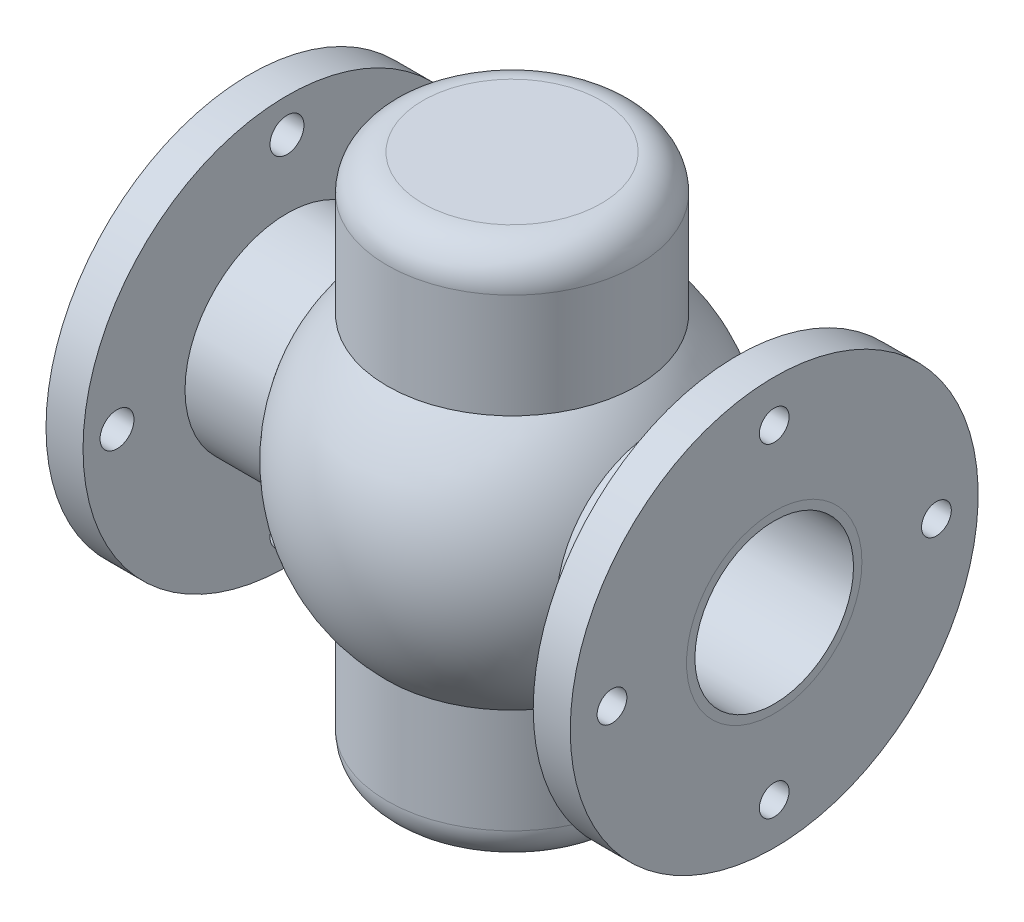
from build123d import *

# Parameters (mm, degrees)
SKETCH1_R                   = 57.15
BASE_EXTRUDE_DEPTH          = 150
BOSS_EXTRUDE1_DEPTH         = 150
BOSS_EXTRUDE1_DEPTH_BACK    = 150
SKETCH2_R                   = 70
FILLET1_R                   = 20
SKETCH18_R                  = 44.45
CUT_EXTRUDE3_DEPTH          = 351.000000086
CUT_EXTRUDE2_REACH          = 353.73
SKETCH15_R                  = 9.5
CIRPATTERN2_COUNT           = 4
SKETCH22_R                  = 67.5
CUT_EXTRUDE5_DEPTH          = 3.1
F_5_8_CLEARANCE_HOLE1_D     = 16.66748
F_5_8_CLEARANCE_HOLE1_DEPTH = 20.75


with BuildPart() as part:
    # Sketch1 → Base-Extrude (new, symmetric)
    with BuildSketch(Plane(origin=(0, 0, 0), x_dir=(0, 0, -1), z_dir=(1, 0, 0))):
        Circle(SKETCH1_R)
    extrude(amount=BASE_EXTRUDE_DEPTH, both=True)

    # Sketch2 → Boss-Extrude1 (add, two sides: drawn at the far end of the back side and taken through both)
    with BuildSketch(Plane(origin=(0, 0, 0), x_dir=(1, 0, 0), z_dir=(0, 1, 0)).offset(-BOSS_EXTRUDE1_DEPTH_BACK)):
        with Locations(Location((0, 0, 0), (0, 0, 270))):
            Circle(SKETCH2_R)
    extrude(amount=BOSS_EXTRUDE1_DEPTH + BOSS_EXTRUDE1_DEPTH_BACK)

    # Sketch3 → Boss-Revolve1 (revolve)
    with BuildSketch(Plane.XY):
        with BuildLine():
            Line((0, -100), (0, 100))
            ThreePointArc((0, 100), (100, 0), (0, -100))
        make_face()
    revolve(axis=Axis((0, -115.862970753, 0), (0, 1, 0)))

    # Fillet1
    fillet1_edges = [part.edges().sort_by_distance(p)[0] for p in [
        (0, -150, -70),
        (0, 150, -70),
    ]]
    fillet(fillet1_edges, radius=FILLET1_R)

    # Sketch18 → Cut-Extrude3 (cut, through all)
    with BuildSketch(Plane.ZY.offset(150)):
        Circle(SKETCH18_R)
    extrude(amount=-CUT_EXTRUDE3_DEPTH, mode=Mode.SUBTRACT)

    # Sketch13 → Boss-Revolve4 (revolve)
    with BuildSketch(Plane.XY, mode=Mode.PRIVATE) as boss_revolve4_sk:
        Polygon((126.15, 57.15), (126.15, 114.3), (146.9, 114.3), (146.9, 67.5), (150, 67.5), (150, 57.15), align=None)
    boss_revolve4 = revolve(boss_revolve4_sk.sketch.rotate(Axis((0, 0, 0), (1, 0, 0)), 90), axis=Axis((0, 0, 0), (1, 0, 0)))

    # Mirror2: Boss-Revolve4 across plane
    add(boss_revolve4.mirror(Plane(origin=(0, 0, 0), x_dir=(0, 0, 1), z_dir=(1, 0, 0))))

    # Sketch15 → Cut-Extrude2 (cut, up to next)
    with BuildSketch(Plane.ZY.offset(146.9), mode=Mode.PRIVATE) as cut_extrude2_sk1:
        with Locations((0, 95.25)):
            Circle(SKETCH15_R)
    cut_extrude2_tool1 = extrude(cut_extrude2_sk1.sketch, amount=-CUT_EXTRUDE2_REACH, mode=Mode.PRIVATE) & part.part
    cut_extrude2 = cut_extrude2_tool1.solids().sort_by_distance((-146.9, 95.25, 0))[0]
    add(cut_extrude2, mode=Mode.SUBTRACT)

    # CirPattern2: Cut-Extrude2 ×4 about axis
    cirpattern2_axis = Axis((0, 0, 0), (1, 0, 0))
    for i in range(1, CIRPATTERN2_COUNT):
        add(cut_extrude2.rotate(cirpattern2_axis, i * 360 / CIRPATTERN2_COUNT), mode=Mode.SUBTRACT)

    # Sketch22 → Cut-Extrude5 (cut)
    with BuildSketch(Plane(origin=(146.9, 0, 0), x_dir=(0, 0, -1), z_dir=(1, 0, 0))):
        with Locations(Location((0, 0, 0), (0, 0, 180))):
            Circle(SKETCH22_R)
    extrude(amount=CUT_EXTRUDE5_DEPTH, mode=Mode.SUBTRACT)

    # 5/8 Clearance Hole1
    with Locations(Plane(origin=(126.15, -86.94526051, 61.229912904), x_dir=(0, 0, 1), z_dir=(-1, 0, 0))):
        with Locations((-61.229912904, 177.798020209), (29.681467244, 86.94526051), (-61.229912904, -3.966119638), (-152.141293051, 86.94526051)):
            Hole(F_5_8_CLEARANCE_HOLE1_D / 2, depth=F_5_8_CLEARANCE_HOLE1_DEPTH)


solid = part.part
